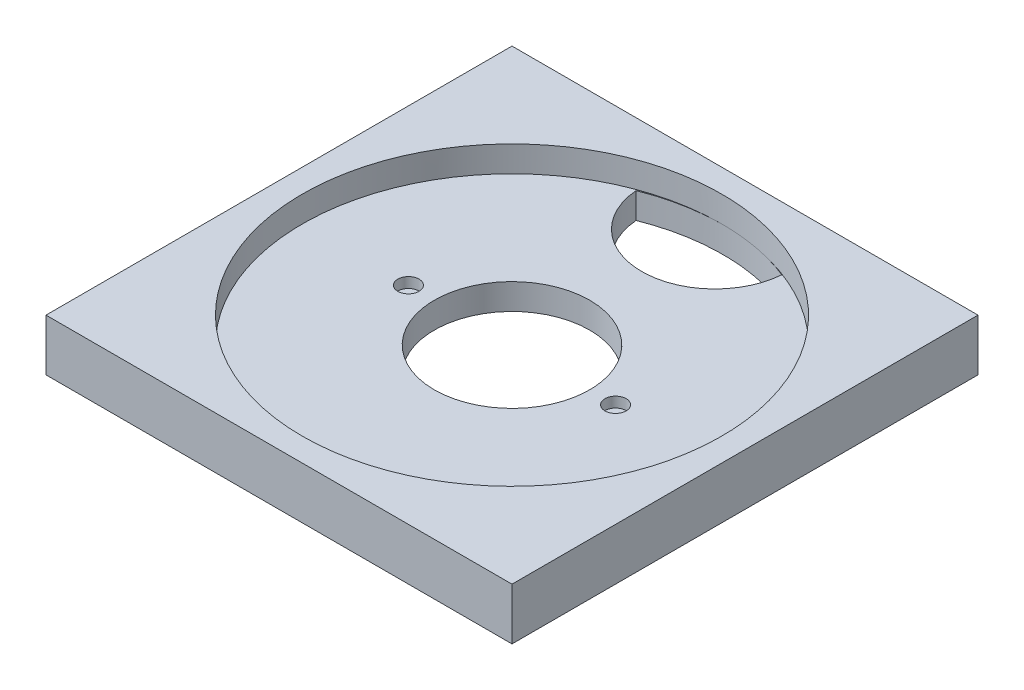
from build123d import *

# Parameters (mm, degrees)
BOSS_EXTRUDE1_DEPTH = 10
SKETCH2_R           = 40.5
CUT_EXTRUDE1_DEPTH  = 5
SKETCH4_R           = 2.05
CUT_EXTRUDE2_DEPTH  = 2
SKETCH5_R           = 15
CUT_EXTRUDE3_DEPTH  = 64.835726674
CUT_EXTRUDE4_DEPTH  = 36


with BuildPart() as part:
    # Sketch1 → Boss-Extrude1 (new body)
    with BuildSketch(Plane(origin=(0, 0, 0), x_dir=(1, 0, 0), z_dir=(0, 1, 0))):
        Polygon((0, -45), (-45, -45), (-45, 45), (0, 45), (45, 45), (45, -45), align=None)
    extrude(amount=BOSS_EXTRUDE1_DEPTH)

    # Sketch2 → Cut-Extrude1 (cut)
    with BuildSketch(Plane(origin=(0, 10, 0), x_dir=(1, 0, 0), z_dir=(0, 1, 0))):
        with Locations(Location((0, 0, 0), (0, 0, 270))):
            Circle(SKETCH2_R)
    extrude(amount=-CUT_EXTRUDE1_DEPTH, mode=Mode.SUBTRACT)

    # Sketch4 → Cut-Extrude2 (cut)
    with BuildSketch(Plane(origin=(0, 5, 0), x_dir=(1, 0, 0), z_dir=(0, 1, 0))):
        with Locations(Location((-20, 0, 0), (0, 0, 270))):
            Circle(SKETCH4_R)
        with Locations(Location((20, 0, 0), (0, 0, 270))):
            Circle(SKETCH4_R)
    extrude(amount=-CUT_EXTRUDE2_DEPTH, mode=Mode.SUBTRACT)

    # Sketch5 → Cut-Extrude3 (cut, through all)
    with BuildSketch(Plane(origin=(0, 5, 0), x_dir=(1, 0, 0), z_dir=(0, 1, 0))):
        with Locations(Location((0, 0, 0), (0, 0, 270))):
            Circle(SKETCH5_R)
    extrude(amount=-CUT_EXTRUDE3_DEPTH, mode=Mode.SUBTRACT)

    # Sketch7 → Cut-Extrude4 (cut)
    with BuildSketch(Plane(origin=(0, 5, 0), x_dir=(1, 0, 0), z_dir=(0, 1, 0))):
        with BuildLine():
            ThreePointArc((-13.841521615, 37.800491998), (0.234545088, 24.817118498), (14.31061179, 37.800491998))
            ThreePointArc((14.31061179, 37.800491998), (0.234545088, 40.503688372), (-13.841521615, 37.800491998))
        make_face()
    extrude(amount=-CUT_EXTRUDE4_DEPTH, mode=Mode.SUBTRACT)


solid = part.part
